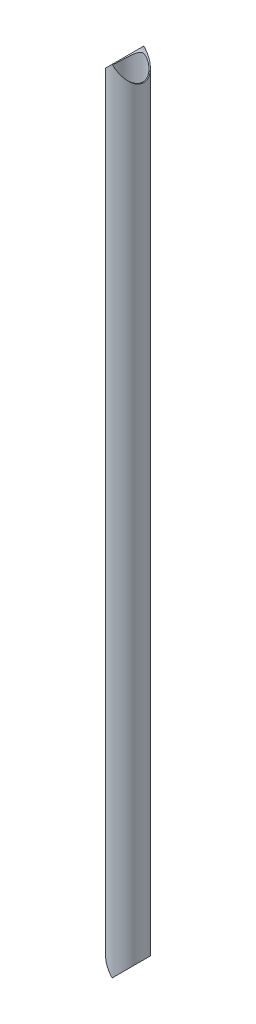
from build123d import *

# Parameters (mm, degrees)
ESBO_O2_R                  = 31.75
ESBO_O2_R_2                = 29.75
RESSALTO_EXTRUS_O1_DEPTH   = 1586.5
CORTE_EXTRUS_O1_DEPTH      = 1588.135273063
CORTE_EXTRUS_O1_DEPTH_BACK = 1588.135273063
ESBO_O3_R                  = 31.75


with BuildPart() as part:
    # Esboço2 → Ressalto-extrusão1 (new body)
    with BuildSketch(Plane(origin=(0, 0, 0), x_dir=(1, 0, 0), z_dir=(0, 1, 0))):
        with Locations(Location((0, 0, 0), (0, 0, 270))):
            Circle(ESBO_O2_R)
        with Locations(Location((0, 0, 0), (0, 0, 270))):
            Circle(ESBO_O2_R_2, mode=Mode.SUBTRACT)
    extrude(amount=RESSALTO_EXTRUS_O1_DEPTH)

    # Esboço3 → Corte-extrusão1 (cut, two sides: drawn at the far end of the back side and taken through both)
    with BuildSketch(Plane(origin=(0, 0, 0), x_dir=(0, 0, -1), z_dir=(1, 0, 0)).offset(-CORTE_EXTRUS_O1_DEPTH_BACK)):
        with Locations((0, 1586.5)):
            Circle(ESBO_O3_R)
        Circle(ESBO_O3_R)
    extrude(amount=CORTE_EXTRUS_O1_DEPTH + CORTE_EXTRUS_O1_DEPTH_BACK, mode=Mode.SUBTRACT)


solid = part.part
